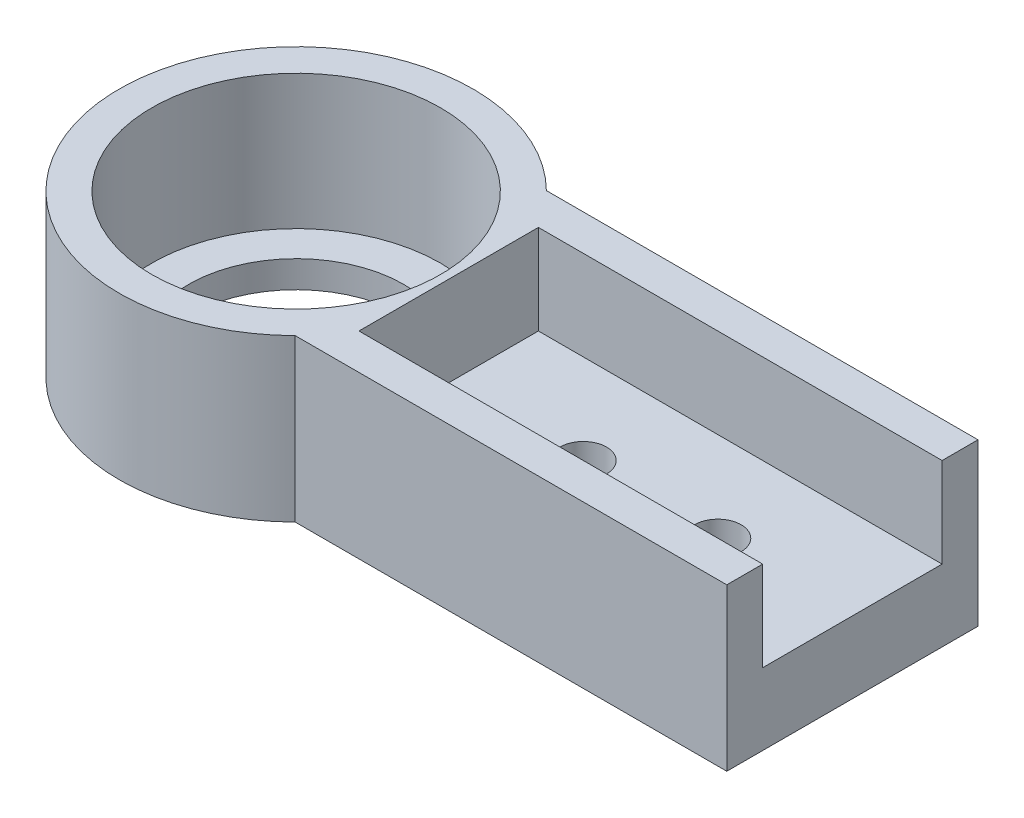
from build123d import *

# Parameters (mm, degrees)
SKETCH_1_R          = 16
EXTRUDE_2_DEPTH     = 11
CUT_EXTRUDE_1_DEPTH = 5
SKETCH_4_W          = 5
SKETCH_4_H          = 4
CUT_EXTRUDE_2_DEPTH = 11
SKETCH_5_R          = 2.6
CUT_EXTRUDE_3_DEPTH = 11
SKETCH_6_R          = 5
CUT_EXTRUDE_4_DEPTH = 3
SKETCH_8_R          = 16
SKETCH_8_R_2        = 12
EXTRUDE_5_DEPTH     = 1
EXTRUDE_START       = 2
SKETCH_9_R          = 12
SKETCH_9_R_2        = 5
EXTRUDE_6_DEPTH     = 2
SKETCH_10_R         = 16.1
CUT_EXTRUDE_5_DEPTH = 10
SKETCH_12_W         = 48.107556011
SKETCH_12_H         = 4
EXTRUDE_7_DEPTH     = 5
SKETCH_13_R         = 16.1
EXTRUDE_8_DEPTH     = 5


with BuildPart() as part:
    # 草图1 → 凸台-拉伸2 (new body)
    with BuildSketch(Plane(origin=(0, 0, 0), x_dir=(1, 0, 0), z_dir=(0, 1, 0))):
        with BuildLine():
            Line((50, 14), (-3.107556011, 14))
            ThreePointArc((-3.107556011, 14), (-36.723082923, 0), (-3.107556011, -14))
            Line((-3.107556011, -14), (50, -14))
            Line((50, -14), (50, -10))
            Line((50, -10), (50, 10))
            Line((50, 10), (50, 14))
        make_face()
        with Locations(Location((-17, 0, 0), (0, 0, 270))):
            Circle(SKETCH_1_R, mode=Mode.SUBTRACT)
    extrude(amount=EXTRUDE_2_DEPTH)

    # 草图3 → 切除-拉伸1 (cut)
    with BuildSketch(Plane(origin=(0, 11, 0), x_dir=(1, 0, 0), z_dir=(0, 1, 0))):
        Polygon((0, 0), (0, 10), (45, 10), (45, -10), (0, -10), align=None)
    extrude(amount=-CUT_EXTRUDE_1_DEPTH, mode=Mode.SUBTRACT)

    # 草图4 → 切除-拉伸2 (cut)
    with BuildSketch(Plane(origin=(0, 11, 0), x_dir=(1, 0, 0), z_dir=(0, 1, 0))):
        with Locations((47.5, 12)):
            Rectangle(SKETCH_4_W, SKETCH_4_H)
        Polygon((45, -14), (50, -14), (50, 10), (45, 10), (45, -10), align=None)
    extrude(amount=-CUT_EXTRUDE_2_DEPTH, mode=Mode.SUBTRACT)

    # 草图5 → 切除-拉伸3 (cut)
    with BuildSketch(Plane(origin=(0, 6, 0), x_dir=(1, 0, 0), z_dir=(0, 1, 0))):
        with Locations(Location((15, 0, 0), (0, 0, 270))):
            Circle(SKETCH_5_R)
        with Locations(Location((30, 0, 0), (0, 0, 270))):
            Circle(SKETCH_5_R)
    extrude(amount=-CUT_EXTRUDE_3_DEPTH, mode=Mode.SUBTRACT)

    # 草图6 → 切除-拉伸4 (cut)
    with BuildSketch(Plane.XZ):
        with Locations(Location((15, 0, 0), (0, 0, 270))):
            Circle(SKETCH_6_R)
        with Locations(Location((30, 0, 0), (0, 0, 270))):
            Circle(SKETCH_6_R)
    extrude(amount=-CUT_EXTRUDE_4_DEPTH, mode=Mode.SUBTRACT)

    # 草图8 → 凸台-拉伸5 (add)
    with BuildSketch(Plane(origin=(0, 0, 0), x_dir=(-1, 0, 0), z_dir=(0, -1, 0))):
        with Locations(Location((17, 0, 0), (0, 0, 90))):
            Circle(SKETCH_8_R)
        with Locations(Location((17, 0, 0), (0, 0, 90))):
            Circle(SKETCH_8_R_2, mode=Mode.SUBTRACT)
    extrude(amount=-EXTRUDE_5_DEPTH)

    # 草图9 → 凸台-拉伸6 (add)
    with BuildSketch(Plane.XZ.offset(EXTRUDE_START)):
        with BuildLine():
            Line((-3.107556011, 14), (45, 14))
            Line((45, 14), (45, -14))
            Line((45, -14), (-3.107556011, -14))
            ThreePointArc((-3.107556011, -14), (-36.723082923, 0), (-3.107556011, 14))
        make_face()
        with Locations(Location((-17, 0, 0), (0, 0, 270))):
            Circle(SKETCH_9_R, mode=Mode.SUBTRACT)
        with Locations(Location((15, 0, 0), (0, 0, 270))):
            Circle(SKETCH_9_R_2, mode=Mode.SUBTRACT)
        with Locations(Location((30, 0, 0), (0, 0, 270))):
            Circle(SKETCH_9_R_2, mode=Mode.SUBTRACT)
    extrude(amount=-EXTRUDE_6_DEPTH)

    # 草图10 → 切除-拉伸5 (cut)
    with BuildSketch(Plane(origin=(0, 11, 0), x_dir=(1, 0, 0), z_dir=(0, 1, 0))):
        with Locations(Location((-17, 0, 0), (0, 0, 270))):
            Circle(SKETCH_10_R)
    extrude(amount=-CUT_EXTRUDE_5_DEPTH, mode=Mode.SUBTRACT)

    # 草图12 → 凸台-拉伸7 (add)
    with BuildSketch(Plane(origin=(0, 11, 0), x_dir=(1, 0, 0), z_dir=(0, 1, 0))):
        with Locations((20.946221995, 12)):
            Rectangle(SKETCH_12_W, SKETCH_12_H)
        with Locations((20.946221995, -12)):
            Rectangle(SKETCH_12_W, SKETCH_12_H)
    extrude(amount=EXTRUDE_7_DEPTH)

    # 草图13 → 凸台-拉伸8 (add)
    with BuildSketch(Plane(origin=(0, 11, 0), x_dir=(1, 0, 0), z_dir=(0, 1, 0))):
        with BuildLine():
            Line((-3.107556011, 14), (0, 10))
            Line((0, 10), (0, -10))
            ThreePointArc((0, -10), (-36.559799946, -2.532632245), (-3.107556011, 14))
        make_face()
        with Locations(Location((-17, 0, 0), (0, 0, 270))):
            Circle(SKETCH_13_R, mode=Mode.SUBTRACT)
    extrude(amount=EXTRUDE_8_DEPTH)


solid = part.part
